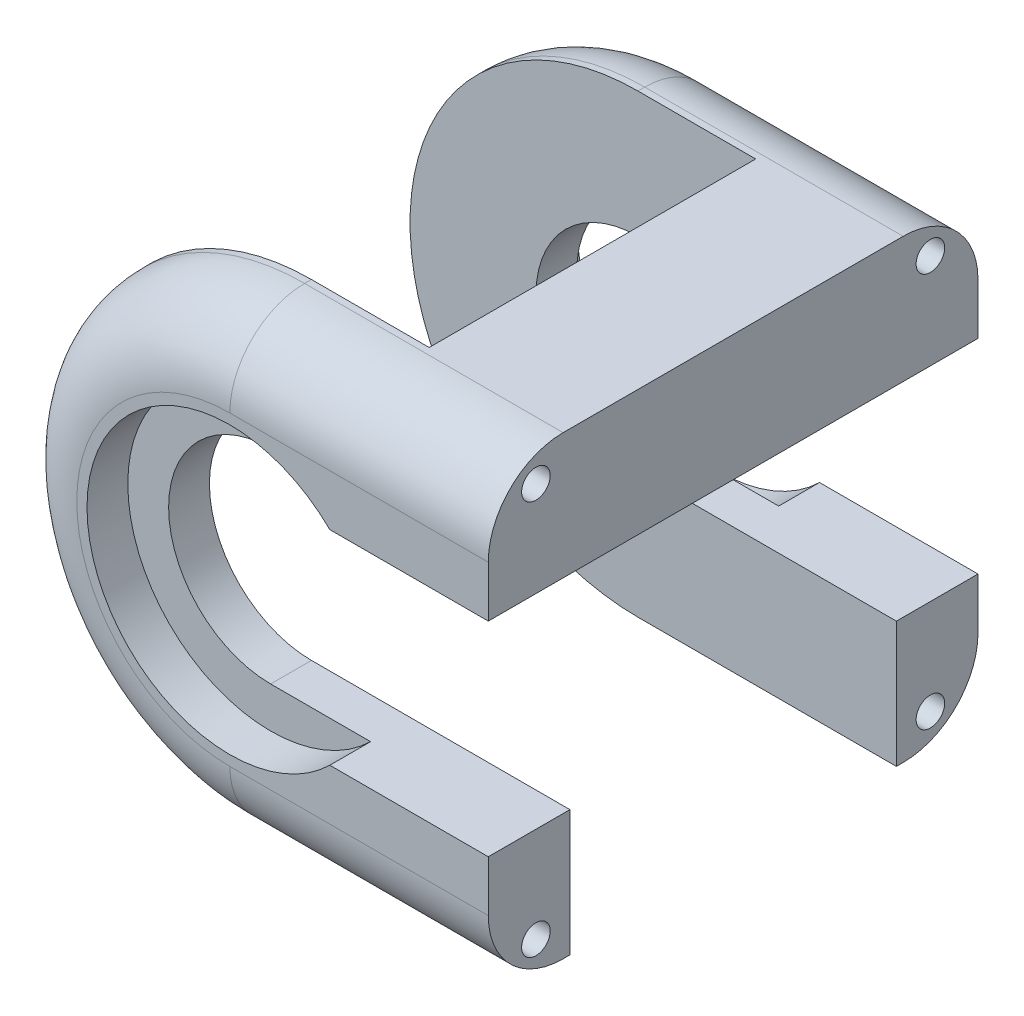
from build123d import *

# Parameters (mm, degrees)
SKETCH1_W             = 38
SKETCH1_H             = 67
BOSS_EXTRUDE1_DEPTH   = 72
SKETCH2_R             = 21
CUT_EXTRUDE1_DEPTH    = 6
CUT_EXTRUDE2_START    = -6
SKETCH3_R             = 21
CUT_EXTRUDE2_DEPTH    = 6
SKETCH4_W             = 50.811271485
SKETCH4_H             = 48
CUT_EXTRUDE3_DEPTH    = 122.594613368
SKETCH6_R             = 15
CUT_EXTRUDE4_DEPTH    = 200
FILLET2_R             = 11
SKETCH10_W            = 47
SKETCH10_H            = 29.40683467
CUT_EXTRUDE7_DEPTH    = 82
CUT_EXTRUDE10_REACH   = 123.595
M5_TAPPED_HOLE1_D     = 4.2
M5_TAPPED_HOLE1_DEPTH = 12
M5_TAPPED_HOLE1_TIP   = 1.2618073
SKETCH13_W            = 0.5
SKETCH13_H            = 18.5
CUT_EXTRUDE11_DEPTH   = 111.701333822


with BuildPart() as part:
    # Sketch1 → Boss-Extrude1 (new body)
    with BuildSketch(Plane.XY):
        with Locations((-19, 33.5)):
            Rectangle(SKETCH1_W, SKETCH1_H)
        with BuildLine():
            Line((-38, 0), (-38, 67))
            ThreePointArc((-38, 67), (-71.5, 33.5), (-38, 0))
        make_face()
    extrude(amount=BOSS_EXTRUDE1_DEPTH)

    # Sketch2 → Cut-Extrude1 (cut)
    with BuildSketch(Plane(origin=(0, 0, 0), x_dir=(-1, 0, 0), z_dir=(0, 0, -1))):
        with Locations((38, 33.5)):
            Circle(SKETCH2_R)
    extrude(amount=-CUT_EXTRUDE1_DEPTH, mode=Mode.SUBTRACT)

    # Sketch3 → Cut-Extrude2 (cut)
    with BuildSketch(Plane.XY.offset(72).offset(CUT_EXTRUDE2_START)):
        with Locations(Location((-38, 33.5, 0), (0, 0, 180))):
            Circle(SKETCH3_R)
    extrude(amount=CUT_EXTRUDE2_DEPTH, mode=Mode.SUBTRACT)

    # Sketch4 → Cut-Extrude3 (cut, through all)
    with BuildSketch(Plane.XZ):
        with Locations((-46.094364258, 36)):
            Rectangle(SKETCH4_W, SKETCH4_H)
    extrude(amount=-CUT_EXTRUDE3_DEPTH, mode=Mode.SUBTRACT)

    # Sketch6 → Cut-Extrude4 (cut)
    with BuildSketch(Plane(origin=(0, 0, 0), x_dir=(-1, 0, 0), z_dir=(0, 0, -1))):
        with Locations((38, 33.5)):
            Circle(SKETCH6_R)
    extrude(amount=-CUT_EXTRUDE4_DEPTH, mode=Mode.SUBTRACT)

    # Fillet2
    fillet2_edges = [part.edges().sort_by_distance(p)[0] for p in [
        (-19, 67, 72),
        (-71.5, 33.5, 72),
        (-19, 0, 72),
        (-19, 0, 0),
        (-71.5, 33.5, 0),
        (-19, 67, 0),
    ]]
    fillet(fillet2_edges, radius=FILLET2_R)

    # Sketch10 → Cut-Extrude7 (cut)
    with BuildSketch(Plane(origin=(0, 0, 0), x_dir=(0, 0, -1), z_dir=(1, 0, 0))):
        with Locations((-36, 14.703417335)):
            Rectangle(SKETCH10_W, SKETCH10_H)
    extrude(amount=-CUT_EXTRUDE7_DEPTH, mode=Mode.SUBTRACT)

    # Sketch11 → Cut-Extrude10 (cut, up to next)
    with BuildSketch(Plane.XY.offset(72), mode=Mode.PRIVATE) as cut_extrude10_sk1:
        with BuildLine():
            Line((-38, 48.5), (-38, 33.5))
            Line((-38, 33.5), (-17, 33.5))
            ThreePointArc((-17, 33.5), (-18.639786835, 41.635241005), (-23.303061543, 48.5))
            Line((-23.303061543, 48.5), (-38, 48.5))
        make_face()
    cut_extrude10_tool1 = extrude(cut_extrude10_sk1.sketch, amount=-CUT_EXTRUDE10_REACH, mode=Mode.PRIVATE) & part.part
    # Sketch11 → Cut-Extrude10 (cut, up to next)
    with BuildSketch(Plane.XY.offset(72), mode=Mode.PRIVATE) as cut_extrude10_sk2:
        with BuildLine():
            ThreePointArc((-23.303061543, 48.5), (-18.639786835, 41.635241005), (-17, 33.5))
            Line((-17, 33.5), (0, 33.5))
            Line((0, 33.5), (0, 48.5))
            Line((0, 48.5), (-23.303061543, 48.5))
        make_face()
    cut_extrude10_tool2 = extrude(cut_extrude10_sk2.sketch, amount=-CUT_EXTRUDE10_REACH, mode=Mode.PRIVATE) & part.part
    # Sketch11 → Cut-Extrude10 (cut, up to next)
    with BuildSketch(Plane.XY.offset(72), mode=Mode.PRIVATE) as cut_extrude10_sk3:
        with BuildLine():
            Line((0, 33.5), (-17, 33.5))
            ThreePointArc((-17, 33.5), (-18.639786835, 25.364758995), (-23.303061543, 18.5))
            Line((-23.303061543, 18.5), (0, 18.5))
            Line((0, 18.5), (0, 33.5))
        make_face()
    cut_extrude10_tool3 = extrude(cut_extrude10_sk3.sketch, amount=-CUT_EXTRUDE10_REACH, mode=Mode.PRIVATE) & part.part
    # Sketch11 → Cut-Extrude10 (cut, up to next)
    with BuildSketch(Plane.XY.offset(72), mode=Mode.PRIVATE) as cut_extrude10_sk4:
        with BuildLine():
            Line((-17, 33.5), (-38, 33.5))
            Line((-38, 33.5), (-38, 18.5))
            Line((-38, 18.5), (-23.303061543, 18.5))
            ThreePointArc((-23.303061543, 18.5), (-18.639786835, 25.364758995), (-17, 33.5))
        make_face()
    cut_extrude10_tool4 = extrude(cut_extrude10_sk4.sketch, amount=-CUT_EXTRUDE10_REACH, mode=Mode.PRIVATE) & part.part
    add(cut_extrude10_tool1.solids().sort_by_distance((-28.39059, 40.602283, 72))[0], mode=Mode.SUBTRACT)
    add(cut_extrude10_tool2.solids().sort_by_distance((-9.565982, 41.399556, 72))[0], mode=Mode.SUBTRACT)
    add(cut_extrude10_tool3.solids().sort_by_distance((-9.565982, 25.600444, 72))[0], mode=Mode.SUBTRACT)
    add(cut_extrude10_tool4.solids().sort_by_distance((-28.39059, 26.397717, 72))[0], mode=Mode.SUBTRACT)

    # M5 Tapped Hole1
    with Locations(Plane(origin=(0, 62.5, 65), x_dir=(0, 1, 0), z_dir=(1, 0, 0))):
        with Locations((0, 0), (0, -58), (-58, -58), (-58, 0)):
            Hole(M5_TAPPED_HOLE1_D / 2, depth=M5_TAPPED_HOLE1_DEPTH)
            with Locations((0, 0, -(M5_TAPPED_HOLE1_DEPTH + M5_TAPPED_HOLE1_TIP / 2))):  # 118° drill point
                Cone(0, M5_TAPPED_HOLE1_D / 2, M5_TAPPED_HOLE1_TIP, mode=Mode.SUBTRACT)

    # Sketch13 → Cut-Extrude11 (cut, through all)
    with BuildSketch(Plane.ZY.offset(20.688728515)):
        with Locations((59.75, 9.25)):
            Rectangle(SKETCH13_W, SKETCH13_H)
        with Locations((12.25, 9.25)):
            Rectangle(SKETCH13_W, SKETCH13_H)
    extrude(amount=-CUT_EXTRUDE11_DEPTH, mode=Mode.SUBTRACT)


solid = part.part
